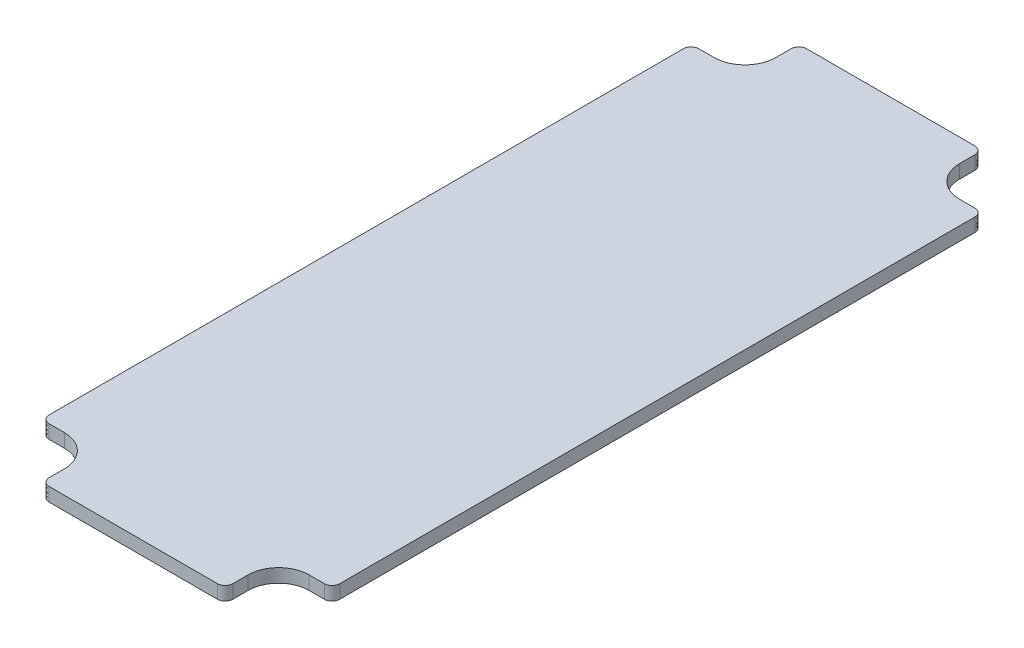
from build123d import *

# Parameters (mm, degrees)
EFFECTSBOARD_DEPTH = 1.57


with BuildPart() as part:
    # Sketch2 → EffectsBoard (new body)
    with BuildSketch(Plane(origin=(0, -15.44984767, 0), x_dir=(-1, 0, 0), z_dir=(0, -1, 0))):
        with BuildLine():
            Line((9.702810165, -43.95246749), (-9.802810165, -43.95246749))
            add(Edge.make_bspline(
                [(-9.802810165, -43.95246749), (-9.915209225, -43.95246749), (-10.13503537, -43.913811014), (-10.458796653, -43.708796653), (-10.663811014, -43.38503537), (-10.70246749, -43.165209225), (-10.70246749, -43.052810165)],
                knots=[0, 0, 0, 0, 0.25, 0.5, 0.75, 1, 1, 1, 1], degree=3))
            Line((-10.70246749, -43.052810165), (-10.70246749, -41.3))
            ThreePointArc((-10.70246749, -41.3), (-11.741515706, -38.791515706), (-14.25, -37.75246749))
            Line((-14.25, -37.75246749), (-16.002810165, -37.75246749))
            add(Edge.make_bspline(
                [(-16.002810165, -37.75246749), (-16.115209225, -37.75246749), (-16.33503537, -37.713811014), (-16.658796653, -37.508796653), (-16.863811014, -37.18503537), (-16.90246749, -36.965209225), (-16.90246749, -36.852810165)],
                knots=[0, 0, 0, 0, 0.25, 0.5, 0.75, 1, 1, 1, 1], degree=3))
            Line((-16.90246749, -36.852810165), (-16.90246749, 36.802810165))
            add(Edge.make_bspline(
                [(-16.90246749, 36.802810165), (-16.90246749, 36.915209225), (-16.863811014, 37.13503537), (-16.658796653, 37.458796653), (-16.33503537, 37.663811014), (-16.115209225, 37.70246749), (-16.002810165, 37.70246749)],
                knots=[0, 0, 0, 0, 0.25, 0.5, 0.75, 1, 1, 1, 1], degree=3))
            Line((-16.002810165, 37.70246749), (-14.25, 37.70246749))
            ThreePointArc((-14.25, 37.70246749), (-11.706160367, 38.756160367), (-10.65246749, 41.3))
            Line((-10.65246749, 41.3), (-10.65246749, 43.052810165))
            add(Edge.make_bspline(
                [(-10.65246749, 43.052810165), (-10.65246749, 43.165209225), (-10.613811014, 43.38503537), (-10.408796653, 43.708796653), (-10.08503537, 43.913811014), (-9.865209225, 43.95246749), (-9.752810165, 43.95246749)],
                knots=[0, 0, 0, 0, 0.25, 0.5, 0.75, 1, 1, 1, 1], degree=3))
            Line((-9.752810165, 43.95246749), (9.752810165, 43.95246749))
            add(Edge.make_bspline(
                [(9.752810165, 43.95246749), (9.865209225, 43.95246749), (10.08503537, 43.913811014), (10.408796653, 43.708796653), (10.613811014, 43.38503537), (10.65246749, 43.165209225), (10.65246749, 43.052810165)],
                knots=[0, 0, 0, 0, 0.25, 0.5, 0.75, 1, 1, 1, 1], degree=3))
            Line((10.65246749, 43.052810165), (10.65246749, 41.3))
            ThreePointArc((10.65246749, 41.3), (11.706160367, 38.756160367), (14.25, 37.70246749))
            Line((14.25, 37.70246749), (16.002810165, 37.70246749))
            add(Edge.make_bspline(
                [(16.002810165, 37.70246749), (16.115209225, 37.70246749), (16.33503537, 37.663811014), (16.658796653, 37.458796653), (16.863811014, 37.13503537), (16.90246749, 36.915209225), (16.90246749, 36.802810165)],
                knots=[0, 0, 0, 0, 0.25, 0.5, 0.75, 1, 1, 1, 1], degree=3))
            Line((16.90246749, 36.802810165), (16.90246749, -36.752810165))
            add(Edge.make_bspline(
                [(16.90246749, -36.752810165), (16.90246749, -36.865209225), (16.863811014, -37.08503537), (16.658796653, -37.408796653), (16.33503537, -37.613811014), (16.115209225, -37.65246749), (16.002810165, -37.65246749)],
                knots=[0, 0, 0, 0, 0.25, 0.5, 0.75, 1, 1, 1, 1], degree=3))
            Line((16.002810165, -37.65246749), (14.25, -37.65246749))
            ThreePointArc((14.25, -37.65246749), (11.670805028, -38.720805028), (10.60246749, -41.3))
            Line((10.60246749, -41.3), (10.60246749, -43.052810165))
            add(Edge.make_bspline(
                [(10.60246749, -43.052810165), (10.60246749, -43.165209225), (10.563811014, -43.38503537), (10.358796653, -43.708796653), (10.03503537, -43.913811014), (9.815209225, -43.95246749), (9.702810165, -43.95246749)],
                knots=[0, 0, 0, 0, 0.25, 0.5, 0.75, 1, 1, 1, 1], degree=3))
        make_face()
    extrude(amount=-EFFECTSBOARD_DEPTH)


solid = part.part
